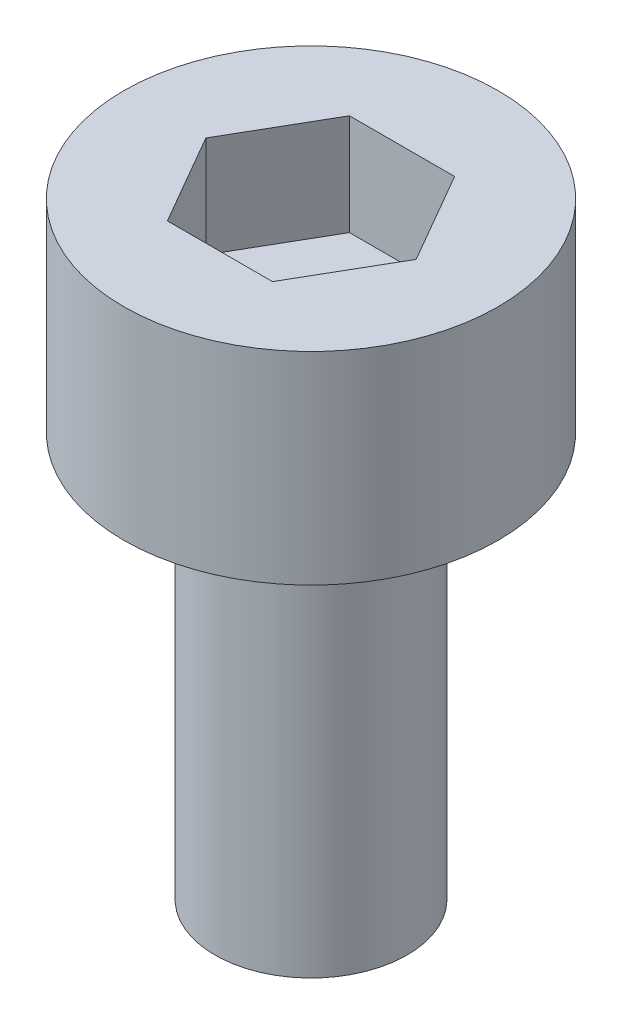
from build123d import *

# Parameters (mm, degrees)
SKETCH1_R           = 1.85
BOSS_EXTRUDE1_DEPTH = 2
CUT_EXTRUDE1_DEPTH  = 1
SKETCH3_R           = 0.95
BOSS_EXTRUDE2_DEPTH = 4


with BuildPart() as part:
    # Sketch1 → Boss-Extrude1 (new body)
    with BuildSketch(Plane(origin=(0, 0, 0), x_dir=(1, 0, 0), z_dir=(0, 1, 0))):
        with Locations(Location((0, 0, 0), (0, 0, 270))):
            Circle(SKETCH1_R)
    extrude(amount=BOSS_EXTRUDE1_DEPTH)

    # Sketch2 → Cut-Extrude1 (cut)
    with BuildSketch(Plane(origin=(0, 2, 0), x_dir=(1, 0, 0), z_dir=(0, 1, 0))):
        Polygon((1.039230485, 0), (0.519615242, 0.9), (-0.519615242, 0.9), (-1.039230485, 0), (-0.519615242, -0.9), (0.519615242, -0.9), align=None)
    extrude(amount=-CUT_EXTRUDE1_DEPTH, mode=Mode.SUBTRACT)

    # Sketch3 → Boss-Extrude2 (add)
    with BuildSketch(Plane.XZ):
        with Locations(Location((0, 0, 0), (0, 0, 270))):
            Circle(SKETCH3_R)
    extrude(amount=BOSS_EXTRUDE2_DEPTH)


solid = part.part
